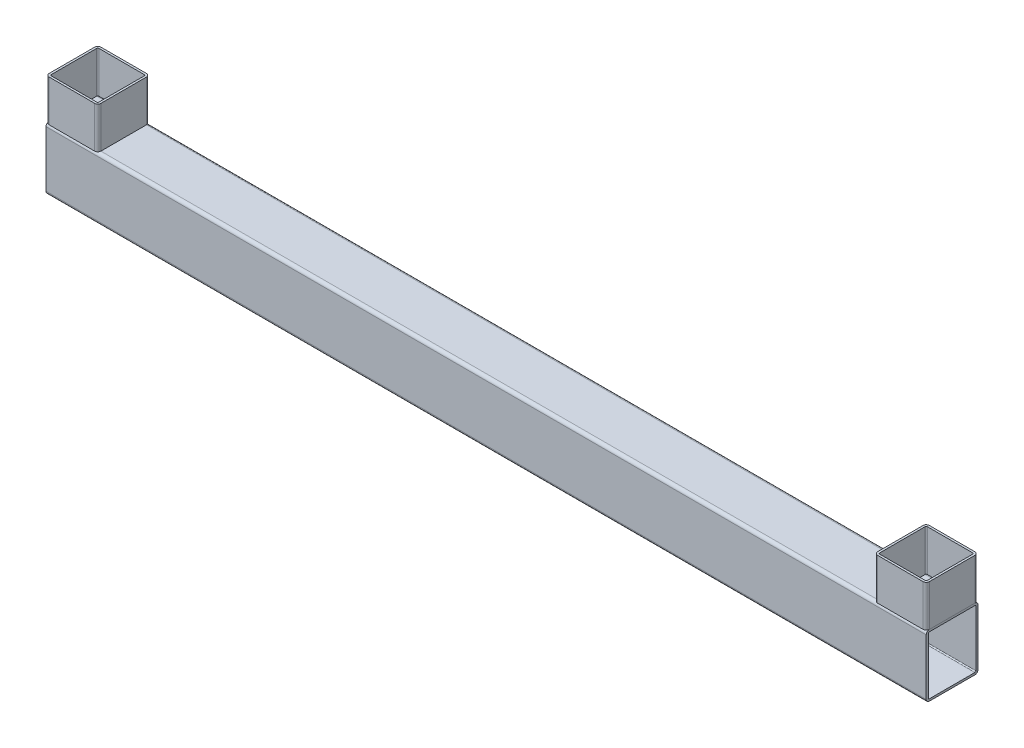
from build123d import *

# Parameters (mm, degrees)
DODANIE_WYCI_GNI_CIE1_DEPTH = 1700
DODANIE_WYCI_GNI_CIE2_DEPTH = 80


with BuildPart() as part:
    # Szkic1 → Dodanie-wyciągnięcie1 (new body)
    with BuildSketch(Plane(origin=(0, 0, 0), x_dir=(0, 0, -1), z_dir=(1, 0, 0))):
        with BuildLine():
            Line((-44, 60), (44, 60))
            ThreePointArc((44, 60), (48.242640687, 58.242640687), (50, 54))
            Line((50, 54), (50, -54))
            ThreePointArc((50, -54), (48.242640687, -58.242640687), (44, -60))
            Line((44, -60), (-44, -60))
            ThreePointArc((-44, -60), (-48.242640687, -58.242640687), (-50, -54))
            Line((-50, -54), (-50, 54))
            ThreePointArc((-50, 54), (-48.242640687, 58.242640687), (-44, 60))
        make_face()
        with BuildLine():
            Line((-44, 56), (44, 56))
            ThreePointArc((44, 56), (45.414213562, 55.414213562), (46, 54))
            Line((46, 54), (46, -54))
            ThreePointArc((46, -54), (45.414213562, -55.414213562), (44, -56))
            Line((44, -56), (-44, -56))
            ThreePointArc((-44, -56), (-45.414213562, -55.414213562), (-46, -54))
            Line((-46, -54), (-46, 54))
            ThreePointArc((-46, 54), (-45.414213562, 55.414213562), (-44, 56))
        make_face(mode=Mode.SUBTRACT)
    extrude(amount=DODANIE_WYCI_GNI_CIE1_DEPTH)


with BuildPart() as body_2:
    # Szkic2 → Dodanie-wyciągnięcie2 (new body)
    with BuildSketch(Plane(origin=(0, 60, 0), x_dir=(1, 0, 0), z_dir=(0, 1, 0))):
        with BuildLine():
            Line((1606, 50), (1694, 50))
            ThreePointArc((1694, 50), (1698.242640687, 48.242640687), (1700, 44))
            Line((1700, 44), (1700, -44))
            ThreePointArc((1700, -44), (1698.242640687, -48.242640687), (1694, -50))
            Line((1694, -50), (1606, -50))
            ThreePointArc((1606, -50), (1601.757359313, -48.242640687), (1600, -44))
            Line((1600, -44), (1600, 44))
            ThreePointArc((1600, 44), (1601.757359313, 48.242640687), (1606, 50))
        make_face()
        with BuildLine():
            Line((1606, 46), (1694, 46))
            ThreePointArc((1694, 46), (1695.414213562, 45.414213562), (1696, 44))
            Line((1696, 44), (1696, -44))
            ThreePointArc((1696, -44), (1695.414213562, -45.414213562), (1694, -46))
            Line((1694, -46), (1606, -46))
            ThreePointArc((1606, -46), (1604.585786438, -45.414213562), (1604, -44))
            Line((1604, -44), (1604, 44))
            ThreePointArc((1604, 44), (1604.585786438, 45.414213562), (1606, 46))
        make_face(mode=Mode.SUBTRACT)
    extrude(amount=DODANIE_WYCI_GNI_CIE2_DEPTH)


with BuildPart() as body_3:
    # Lustro3: mirrored copy
    add(body_2.part.mirror(Plane.ZY.offset(-850)))


solid = Compound([part.part, body_2.part, body_3.part])
